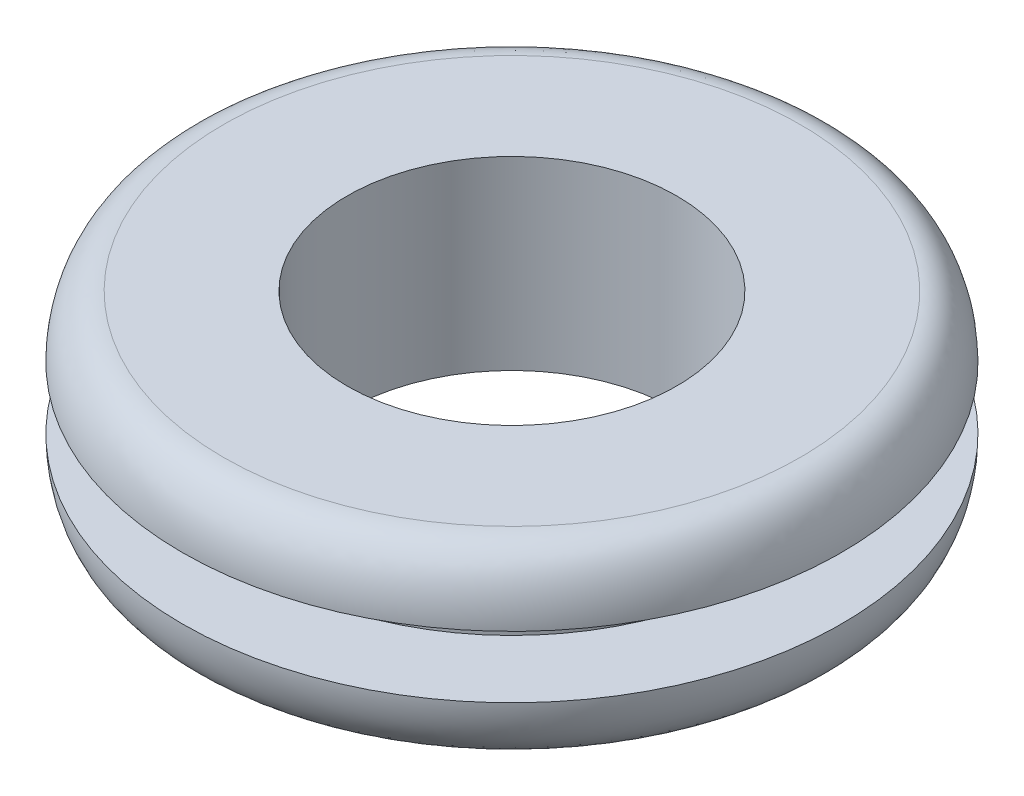
from build123d import *


with BuildPart() as part:
    # Sketch1 → Revolve1 (revolve)
    with BuildSketch(Plane.XY, mode=Mode.PRIVATE) as revolve1_sk:
        with BuildLine():
            Line((-6.35, 3.571875), (-6.35, -3.571875))
            Line((-6.35, -3.571875), (-11.1125, -3.571875))
            add(Edge.make_bspline(
                [(-11.1125, -3.571875), (-12.258265746, -3.571875), (-12.7, -2.229707331), (-12.7, -1.190625)],
                knots=[0, 0, 0, 0, 1, 1, 1, 1], degree=3))
            Line((-12.7, -1.190625), (-9.525, -1.190625))
            Line((-9.525, -1.190625), (-9.525, 1.190625))
            Line((-9.525, 1.190625), (-12.7, 1.190625))
            add(Edge.make_bspline(
                [(-11.1125, 3.571875), (-12.258265746, 3.571875), (-12.7, 2.229707331), (-12.7, 1.190625)],
                knots=[0, 0, 0, 0, 1, 1, 1, 1], degree=3))
            Line((-11.1125, 3.571875), (-6.35, 3.571875))
        make_face()
    revolve(revolve1_sk.sketch.rotate(Axis((0, 96.264631407, 0), (0, -1, 0)), 270), axis=Axis((0, 96.264631407, 0), (0, -1, 0)))


solid = part.part
